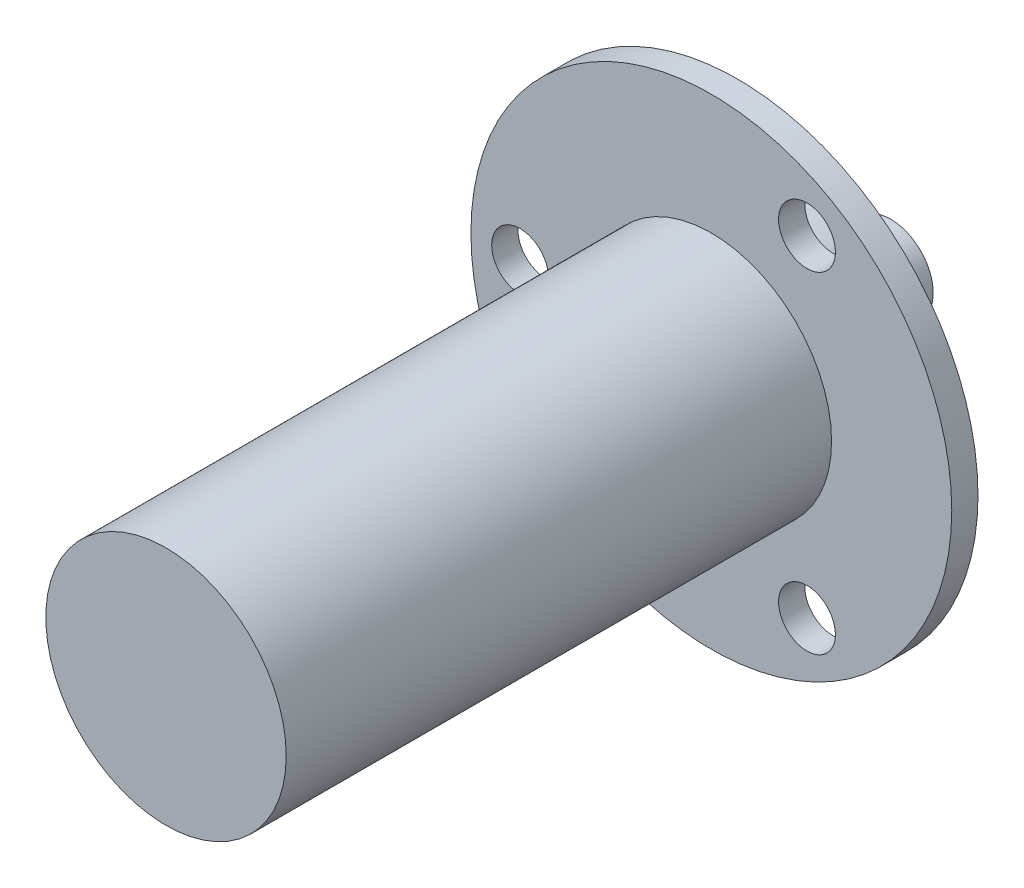
from build123d import *

# Parameters (mm, degrees)
ESQUISSE1_R        = 11
BOSS_EXTRU_1_DEPTH = 49.9
ESQUISSE2_R        = 22
ESQUISSE2_R_2      = 2.6
BOSS_EXTRU_2_DEPTH = 2.4
BOSS_EXTRU_3_START = 5
ESQUISSE3_R        = 11
BOSS_EXTRU_3_DEPTH = 5
ESQUISSE4_R        = 3.9
BOSS_EXTRU_4_DEPTH = 9


with BuildPart() as part:
    # Esquisse1 → Boss.-Extru.1 (new body)
    with BuildSketch(Plane.XY):
        Circle(ESQUISSE1_R)
    extrude(amount=BOSS_EXTRU_1_DEPTH)

    # Esquisse2 → Boss.-Extru.2 (add)
    with BuildSketch(Plane(origin=(0, 0, 0), x_dir=(-1, 0, 0), z_dir=(0, 0, -1))):
        Circle(ESQUISSE2_R)
        with Locations((17.5, 0)):
            Circle(ESQUISSE2_R_2, mode=Mode.SUBTRACT)
        with Locations((-8.75, -15.155444566)):
            Circle(ESQUISSE2_R_2, mode=Mode.SUBTRACT)
        with Locations((-8.75, 15.155444566)):
            Circle(ESQUISSE2_R_2, mode=Mode.SUBTRACT)
    extrude(amount=BOSS_EXTRU_2_DEPTH)

    # Esquisse3 → Boss.-Extru.3 (add)
    with BuildSketch(Plane(origin=(0, 0, -2.4), x_dir=(-1, 0, 0), z_dir=(0, 0, -1)).offset(BOSS_EXTRU_3_START)):
        with Locations(Location((0, 0, 0), (0, 0, 180))):
            Circle(ESQUISSE3_R)
    extrude(amount=-BOSS_EXTRU_3_DEPTH)

    # Esquisse4 → Boss.-Extru.4 (add)
    with BuildSketch(Plane(origin=(0, 0, -7.4), x_dir=(-1, 0, 0), z_dir=(0, 0, -1))):
        Circle(ESQUISSE4_R)
    extrude(amount=BOSS_EXTRU_4_DEPTH)


solid = part.part
